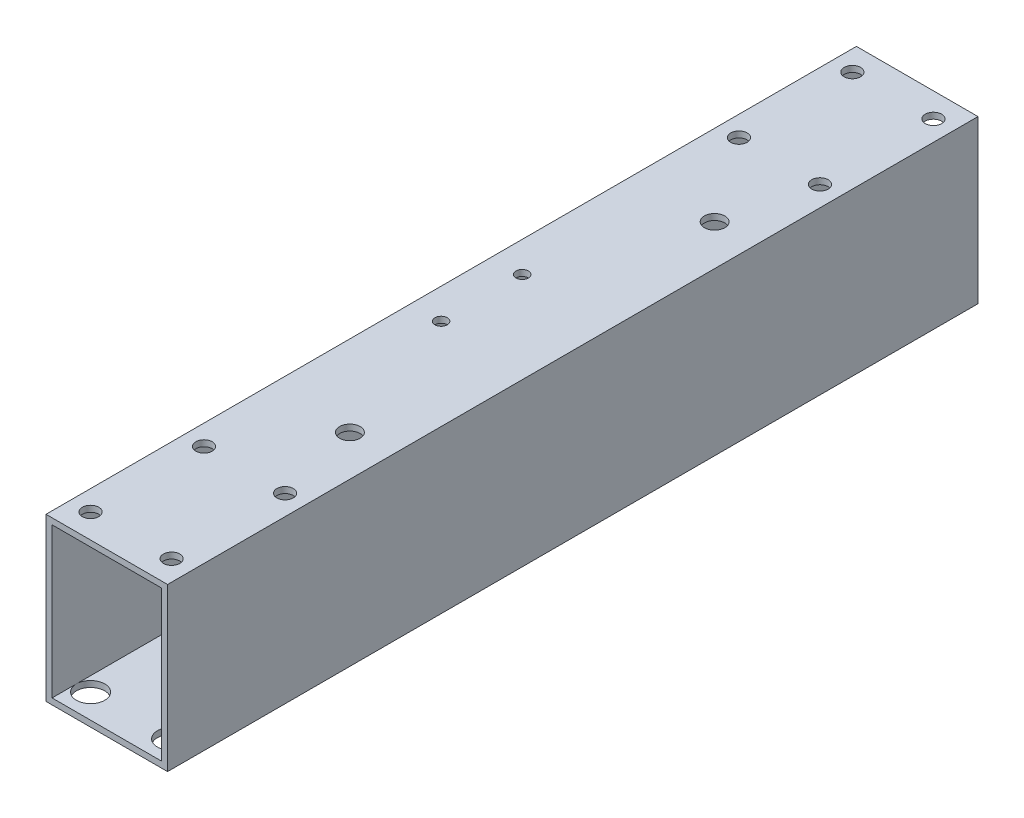
from build123d import *

# Parameters (mm, degrees)
SKETCH_1_W          = 30
SKETCH_1_H          = 40
SKETCH_1_W_2        = 27
SKETCH_1_H_2        = 37
EXTRUDE_1_DEPTH     = 100
SKETCH_3_R          = 1.525
CUT_EXTRUDE_2_DEPTH = 50
SKETCH_5_R          = 3.15
CUT_EXTRUDE_4_DEPTH = 3
SKETCH_6_R          = 2.525
CUT_EXTRUDE_5_DEPTH = 50
SKETCH_7_R          = 2.025
CUT_EXTRUDE_6_DEPTH = 10
SKETCH_8_R          = 3.5
CUT_EXTRUDE_7_DEPTH = 5


with BuildPart() as part:
    # 草图1 → 凸台-拉伸1 (new, symmetric)
    with BuildSketch(Plane.XY):
        Rectangle(SKETCH_1_W, SKETCH_1_H)
        Rectangle(SKETCH_1_W_2, SKETCH_1_H_2, mode=Mode.SUBTRACT)
    extrude(amount=EXTRUDE_1_DEPTH, both=True)

    # 草图3 → 切除-拉伸2 (cut)
    with BuildSketch(Plane(origin=(0, 20, 0), x_dir=(1, 0, 0), z_dir=(0, 1, 0))):
        with Locations((-7.5, 10)):
            Circle(SKETCH_3_R)
        with Locations((-7.5, -10)):
            Circle(SKETCH_3_R)
    extrude(amount=-CUT_EXTRUDE_2_DEPTH, mode=Mode.SUBTRACT)

    # 草图5 → 切除-拉伸4 (cut)
    with BuildSketch(Plane.XZ.offset(20)):
        with Locations((-7.5, 10)):
            Circle(SKETCH_5_R)
        with Locations((-7.5, -10)):
            Circle(SKETCH_5_R)
    extrude(amount=-CUT_EXTRUDE_4_DEPTH, mode=Mode.SUBTRACT)

    # 草图6 → 切除-拉伸5 (cut)
    with BuildSketch(Plane(origin=(0, 20, 0), x_dir=(1, 0, 0), z_dir=(0, 1, 0))):
        with Locations((5, 45)):
            Circle(SKETCH_6_R)
        with Locations((5, -45)):
            Circle(SKETCH_6_R)
    extrude(amount=-CUT_EXTRUDE_5_DEPTH, mode=Mode.SUBTRACT)

    # 草图7 → 切除-拉伸6 (cut)
    with BuildSketch(Plane.XZ.offset(-18.5)):
        with Locations((-10, 94)):
            Circle(SKETCH_7_R)
        with Locations((10, 94)):
            Circle(SKETCH_7_R)
        with Locations((10, 66)):
            Circle(SKETCH_7_R)
        with Locations((-10, 66)):
            Circle(SKETCH_7_R)
        with Locations((10, -66)):
            Circle(SKETCH_7_R)
        with Locations((-10, -66)):
            Circle(SKETCH_7_R)
        with Locations((10, -94)):
            Circle(SKETCH_7_R)
        with Locations((-10, -94)):
            Circle(SKETCH_7_R)
    extrude(amount=-CUT_EXTRUDE_6_DEPTH, mode=Mode.SUBTRACT)

    # 草图8 → 切除-拉伸7 (cut, symmetric)
    with BuildSketch(Plane(origin=(0, -18.5, 0), x_dir=(1, 0, 0), z_dir=(0, 1, 0))):
        with Locations((-10, 94)):
            Circle(SKETCH_8_R)
        with Locations((10, 94)):
            Circle(SKETCH_8_R)
        with Locations((10, 66)):
            Circle(SKETCH_8_R)
        with Locations((-10, 66)):
            Circle(SKETCH_8_R)
        with Locations((10, -66)):
            Circle(SKETCH_8_R)
        with Locations((-10, -66)):
            Circle(SKETCH_8_R)
        with Locations((-10, -94)):
            Circle(SKETCH_8_R)
        with Locations((10, -94)):
            Circle(SKETCH_8_R)
    extrude(amount=CUT_EXTRUDE_7_DEPTH, both=True, mode=Mode.SUBTRACT)


solid = part.part
